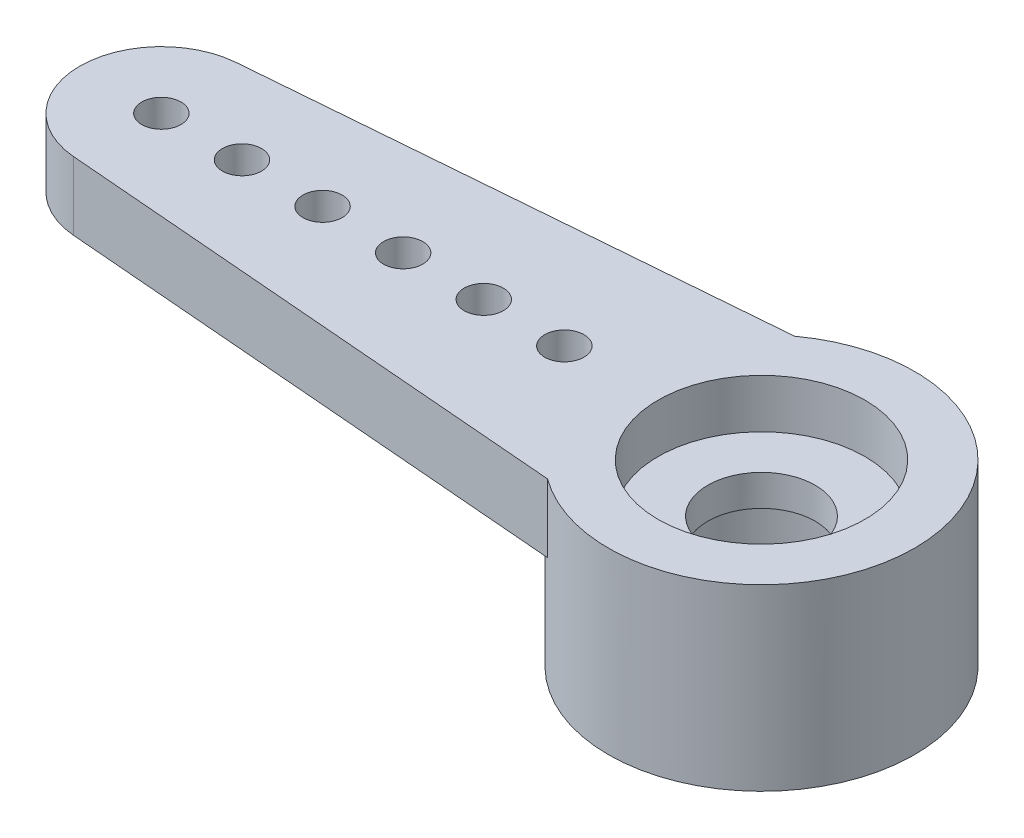
from build123d import *

# Parameters (mm, degrees)
EXTRUDE17_DEPTH = 1.6129
EXTRUDE19_START = -4.2291
SKETCH19_R      = 3.6195
EXTRUDE19_DEPTH = 4.2291
SKETCH20_R      = 0.46355
SKETCH20_R_2    = 1.27
EXTRUDE20_DEPTH = 18.050548166
SKETCH21_R      = 2.44475
EXTRUDE21_DEPTH = 1.1557
SKETCH22_R      = 2.286
EXTRUDE22_DEPTH = 2.3368


with BuildPart() as part:
    # Sketch18 → Extrude17 (new body)
    with BuildSketch(Plane(origin=(0, 0, 0), x_dir=(1, 0, 0), z_dir=(0, 1, 0))):
        with BuildLine():
            Line((-14.34305969, 1.923991942), (-2.13741415, 2.921))
            ThreePointArc((-2.13741415, 2.921), (3.6195, 0), (-2.13741415, -2.921))
            Line((-2.13741415, -2.921), (-14.34305969, -1.923991942))
            ThreePointArc((-14.34305969, -1.923991942), (-16.1163, 0), (-14.34305969, 1.923991942))
        make_face()
    extrude(amount=EXTRUDE17_DEPTH)

    # Sketch19 → Extrude19 (add)
    with BuildSketch(Plane(origin=(0, 1.6129, 0), x_dir=(1, 0, 0), z_dir=(0, 1, 0)).offset(EXTRUDE19_START)):
        with Locations(Location((0, 0, 0), (0, 0, 126.194447475))):
            Circle(SKETCH19_R)
    extrude(amount=EXTRUDE19_DEPTH)

    # Sketch20 → Extrude20 (cut, through all)
    with BuildSketch(Plane(origin=(0, 1.6129, 0), x_dir=(1, 0, 0), z_dir=(0, 1, 0))):
        with Locations(Location((-14.1859, 0, 0), (0, 0, 270))):
            Circle(SKETCH20_R)
        with Locations(Location((0, 0, 0), (0, 0, 270))):
            Circle(SKETCH20_R_2)
        with Locations(Location((-4.6609, 0, 0), (0, 0, 270))):
            Circle(SKETCH20_R)
        with Locations(Location((-6.5659, 0, 0), (0, 0, 270))):
            Circle(SKETCH20_R)
        with Locations(Location((-8.4709, 0, 0), (0, 0, 270))):
            Circle(SKETCH20_R)
        with Locations(Location((-10.3759, 0, 0), (0, 0, 270))):
            Circle(SKETCH20_R)
        with Locations(Location((-12.2809, 0, 0), (0, 0, 270))):
            Circle(SKETCH20_R)
    extrude(amount=-EXTRUDE20_DEPTH, mode=Mode.SUBTRACT)

    # Sketch21 → Extrude21 (cut)
    with BuildSketch(Plane(origin=(0, 1.6129, 0), x_dir=(1, 0, 0), z_dir=(0, 1, 0))):
        with Locations(Location((0, 0, 0), (0, 0, 270))):
            Circle(SKETCH21_R)
    extrude(amount=-EXTRUDE21_DEPTH, mode=Mode.SUBTRACT)

    # Sketch22 → Extrude22 (cut)
    with BuildSketch(Plane.XZ.offset(2.6162)):
        with Locations(Location((0, 0, 0), (0, 0, 270))):
            Circle(SKETCH22_R)
    extrude(amount=-EXTRUDE22_DEPTH, mode=Mode.SUBTRACT)


solid = part.part
